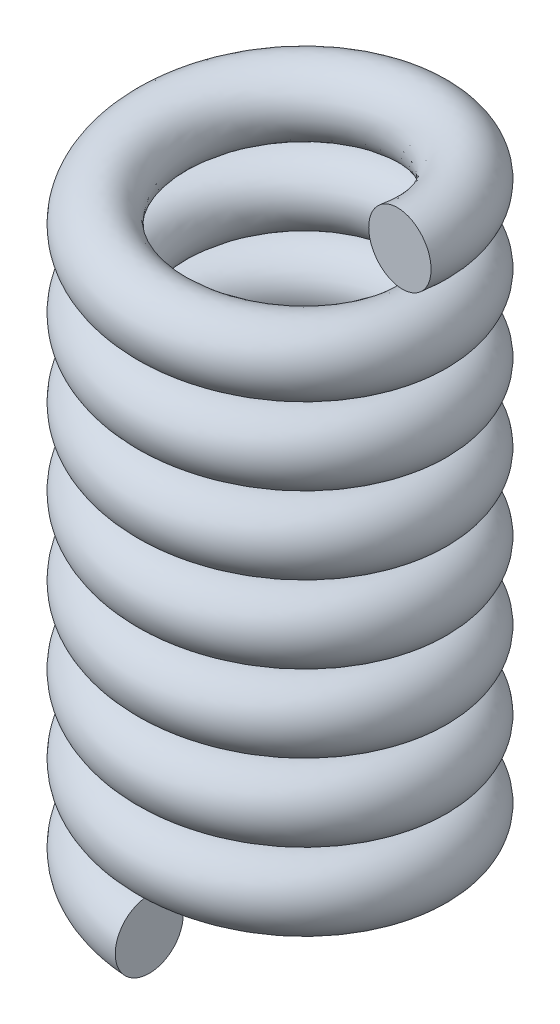
from build123d import *

# Parameters (mm, degrees)
AUSTRAGUNG2_PITCH  = 29.5
AUSTRAGUNG2_HEIGHT = 229
AUSTRAGUNG2_RADIUS = 50
SKIZZE5_R          = 13


with BuildPart() as part:
    # Austragung2: sweep along a helix
    with BuildLine() as austragung2_path:
        Helix(AUSTRAGUNG2_PITCH, AUSTRAGUNG2_HEIGHT, AUSTRAGUNG2_RADIUS, center=(0, 0, 0), direction=(0, 1, 0), lefthand=True)
    # Skizze5 → Austragung2 (sweep)
    with BuildSketch(Plane(origin=(0, 0, 0), x_dir=(0, 0, -1), z_dir=(1, 0, 0))):
        with Locations((-50, 0)):
            Circle(SKIZZE5_R)
    sweep(path=austragung2_path.line, is_frenet=True)


solid = part.part
